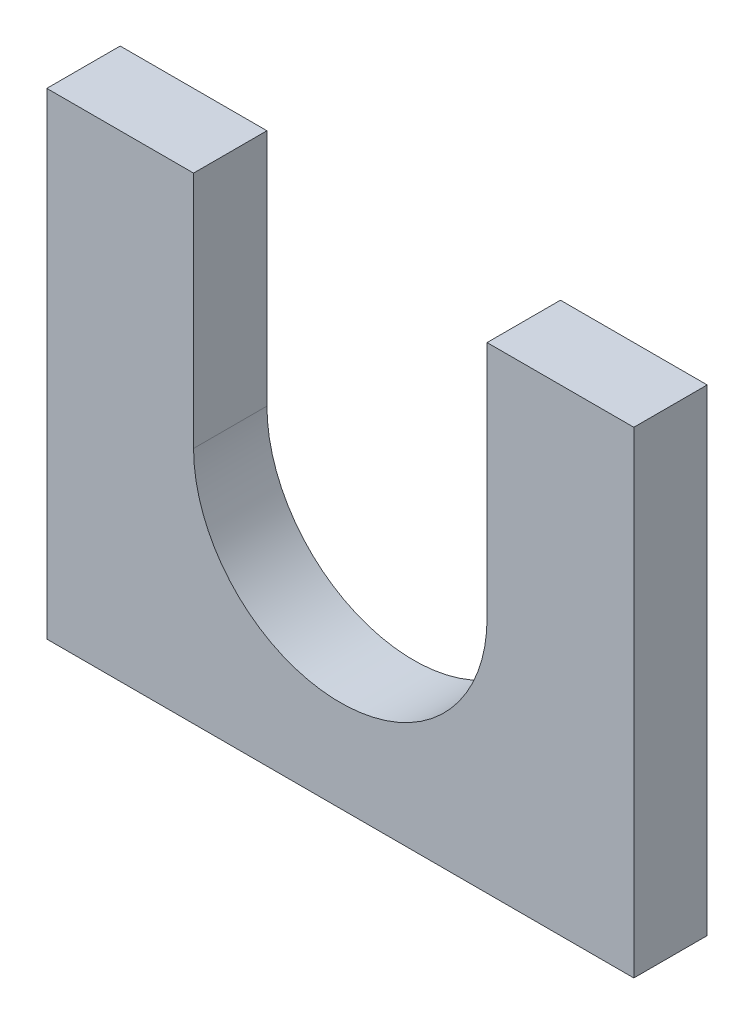
from build123d import *

# Parameters (mm, degrees)
CROQUIS1_W              = 16
CROQUIS1_H              = 2
SALIENTE_EXTRUIR1_DEPTH = 13
CORTAR_EXTRUIR1_DEPTH   = 21.712315177


with BuildPart() as part:
    # Croquis1 → Saliente-Extruir1 (new body)
    with BuildSketch(Plane(origin=(0, 0, 0), x_dir=(1, 0, 0), z_dir=(0, 1, 0))):
        with Locations((8, 1)):
            Rectangle(CROQUIS1_W, CROQUIS1_H)
    extrude(amount=SALIENTE_EXTRUIR1_DEPTH)

    # Croquis2 → Cortar-Extruir1 (cut, through all)
    with BuildSketch(Plane(origin=(0, 0, -2), x_dir=(-1, 0, 0), z_dir=(0, 0, -1))):
        with BuildLine():
            Line((-4, 6.5), (-4, 13))
            Line((-4, 13), (-12, 13))
            Line((-12, 13), (-12, 6.5))
            ThreePointArc((-12, 6.5), (-8, 2.5), (-4, 6.5))
        make_face()
    extrude(amount=-CORTAR_EXTRUIR1_DEPTH, mode=Mode.SUBTRACT)


solid = part.part
